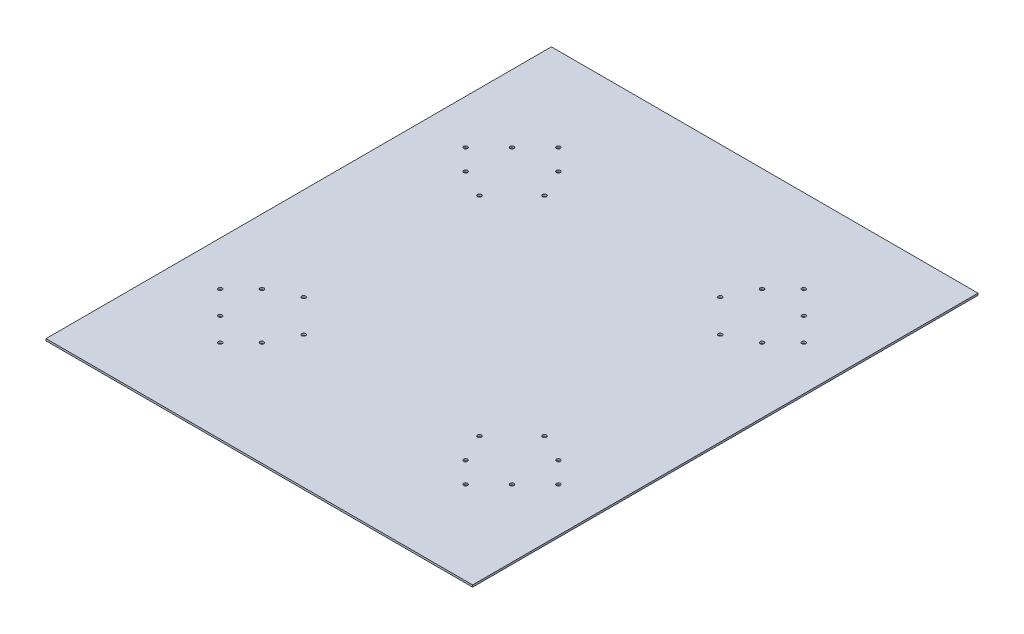
from build123d import *

# Parameters (mm, degrees)
SKETCH2_W           = 650
SKETCH2_H           = 770
SKETCH2_R           = 3
BOSS_EXTRUDE2_DEPTH = 3


with BuildPart() as part:
    # Sketch2 → Boss-Extrude2 (new body)
    with BuildSketch(Plane(origin=(0, 1310.548413309, 0), x_dir=(1, 0, 0), z_dir=(0, 1, 0))):
        with Locations((1065.777273447, -1504.227226955)):
            Rectangle(SKETCH2_W, SKETCH2_H)
        with Locations(Location((843.462901442, -1726.54159896, 0), (0, 0, 180))):
            Circle(SKETCH2_R, mode=Mode.SUBTRACT)
        with Locations(Location((878.818240502, -1761.896938019, 0), (0, 0, 180))):
            Circle(SKETCH2_R, mode=Mode.SUBTRACT)
        with Locations(Location((910.638045655, -1730.077132866, 0), (0, 0, 180))):
            Circle(SKETCH2_R, mode=Mode.SUBTRACT)
        with Locations(Location((808.107562383, -1691.186259901, 0), (0, 0, 180))):
            Circle(SKETCH2_R, mode=Mode.SUBTRACT)
        with Locations(Location((839.927367536, -1659.366454747, 0), (0, 0, 180))):
            Circle(SKETCH2_R, mode=Mode.SUBTRACT)
        with Locations(Location((931.851249091, -1687.650725995, 0), (0, 0, 180))):
            Circle(SKETCH2_R, mode=Mode.SUBTRACT)
        with Locations(Location((882.353774408, -1638.153251312, 0), (0, 0, 180))):
            Circle(SKETCH2_R, mode=Mode.SUBTRACT)
        with Locations(Location((839.927367536, -1349.087999163, 0), (0, 0, 180))):
            Circle(SKETCH2_R, mode=Mode.SUBTRACT)
        with Locations(Location((808.107562383, -1317.268194009, 0), (0, 0, 180))):
            Circle(SKETCH2_R, mode=Mode.SUBTRACT)
        with Locations(Location((882.353774408, -1370.301202598, 0), (0, 0, 180))):
            Circle(SKETCH2_R, mode=Mode.SUBTRACT)
        with Locations(Location((931.851249091, -1320.803727915, 0), (0, 0, 180))):
            Circle(SKETCH2_R, mode=Mode.SUBTRACT)
        with Locations(Location((843.462901442, -1281.91285495, 0), (0, 0, 180))):
            Circle(SKETCH2_R, mode=Mode.SUBTRACT)
        with Locations(Location((910.638045655, -1278.377321044, 0), (0, 0, 180))):
            Circle(SKETCH2_R, mode=Mode.SUBTRACT)
        with Locations(Location((878.818240502, -1246.55751589, 0), (0, 0, 180))):
            Circle(SKETCH2_R, mode=Mode.SUBTRACT)
        with Locations(Location((1199.703297804, -1320.803727915, 0), (0, 0, 180))):
            Circle(SKETCH2_R, mode=Mode.SUBTRACT)
        with Locations(Location((1249.200772487, -1370.301202598, 0), (0, 0, 180))):
            Circle(SKETCH2_R, mode=Mode.SUBTRACT)
        with Locations(Location((1291.627179358, -1349.087999163, 0), (0, 0, 180))):
            Circle(SKETCH2_R, mode=Mode.SUBTRACT)
        with Locations(Location((1323.446984512, -1317.268194009, 0), (0, 0, 180))):
            Circle(SKETCH2_R, mode=Mode.SUBTRACT)
        with Locations(Location((1220.91650124, -1278.377321044, 0), (0, 0, 180))):
            Circle(SKETCH2_R, mode=Mode.SUBTRACT)
        with Locations(Location((1252.736306393, -1246.55751589, 0), (0, 0, 180))):
            Circle(SKETCH2_R, mode=Mode.SUBTRACT)
        with Locations(Location((1288.091645453, -1281.91285495, 0), (0, 0, 180))):
            Circle(SKETCH2_R, mode=Mode.SUBTRACT)
        with Locations(Location((1291.627179358, -1659.366454747, 0), (0, 0, 180))):
            Circle(SKETCH2_R, mode=Mode.SUBTRACT)
        with Locations(Location((1199.703297804, -1687.650725995, 0), (0, 0, 180))):
            Circle(SKETCH2_R, mode=Mode.SUBTRACT)
        with Locations(Location((1249.200772487, -1638.153251312, 0), (0, 0, 180))):
            Circle(SKETCH2_R, mode=Mode.SUBTRACT)
        with Locations(Location((1323.446984512, -1691.186259901, 0), (0, 0, 180))):
            Circle(SKETCH2_R, mode=Mode.SUBTRACT)
        with Locations(Location((1220.91650124, -1730.077132866, 0), (0, 0, 180))):
            Circle(SKETCH2_R, mode=Mode.SUBTRACT)
        with Locations(Location((1252.736306393, -1761.896938019, 0), (0, 0, 180))):
            Circle(SKETCH2_R, mode=Mode.SUBTRACT)
        with Locations(Location((1288.091645453, -1726.54159896, 0), (0, 0, 180))):
            Circle(SKETCH2_R, mode=Mode.SUBTRACT)
    extrude(amount=BOSS_EXTRUDE2_DEPTH)


solid = part.part
